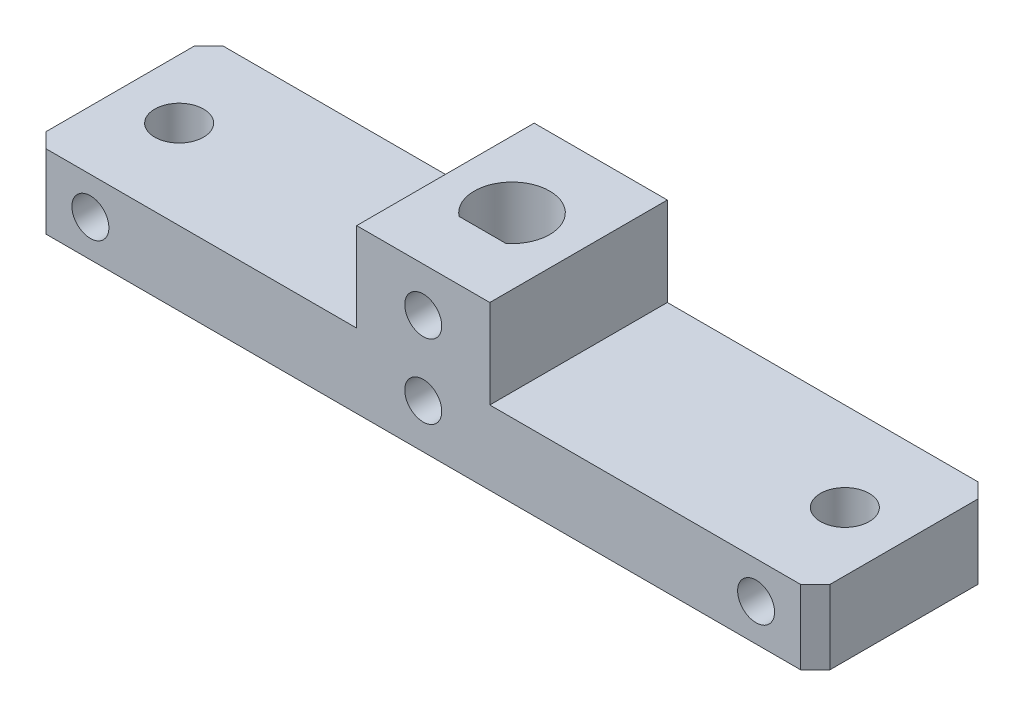
from build123d import *

# Parameters (mm, degrees)
BODY_EXTRUDE_DEPTH         = 12
M4X0_7_TAPPED_HOLE6_D      = 3.3
CUT_EXTRUDE1_DEPTH         = 32.10064308
M3X0_5_TAPPED_HOLE1_REACH  = 33.101
M3X0_5_TAPPED_HOLE1_BORE_R = 1.25
CHAMFER1_SIZE              = 1


with BuildPart() as part:
    # Body Sketch → Body Extrude (new body)
    with BuildSketch(Plane.XY):
        Polygon((-26.5, 0), (26.5, 0), (26.5, 5), (4.5, 5), (4.5, 11), (-4.5, 11), (-4.5, 5), (-26.5, 5), align=None)
    extrude(amount=-BODY_EXTRUDE_DEPTH)

    # M4x0.7 Tapped Hole6 (through all)
    with Locations(Plane.XZ):
        with Locations((-22.5, -6), (22.5, -6)):
            Hole(M4X0_7_TAPPED_HOLE6_D / 2)

    # Sketch2 → Cut-Extrude1 (cut, through all)
    with BuildSketch(Plane(origin=(0, 0, 0), x_dir=(1, 0, 0), z_dir=(0, 1, 0))):
        with BuildLine():
            Line((-1.581929202, 4), (1.581929202, 4))
            ThreePointArc((1.581929202, 4), (0, 8.55), (-1.581929202, 4))
        make_face()
    extrude(amount=CUT_EXTRUDE1_DEPTH, mode=Mode.SUBTRACT)

    # M3x0.5 Tapped Hole1 bore → M3x0.5 Tapped Hole1 (cut, up to next)
    with BuildSketch(Plane.XY, mode=Mode.PRIVATE) as m3x0_5_tapped_hole1_sk1:
        with Locations((-22.5, 2.5)):
            Circle(M3X0_5_TAPPED_HOLE1_BORE_R)
    m3x0_5_tapped_hole1_tool1 = extrude(m3x0_5_tapped_hole1_sk1.sketch, amount=-M3X0_5_TAPPED_HOLE1_REACH, mode=Mode.PRIVATE) & part.part
    # M3x0.5 Tapped Hole1 bore → M3x0.5 Tapped Hole1 (cut, up to next)
    with BuildSketch(Plane.XY, mode=Mode.PRIVATE) as m3x0_5_tapped_hole1_sk2:
        with Locations((22.5, 2.5)):
            Circle(M3X0_5_TAPPED_HOLE1_BORE_R)
    m3x0_5_tapped_hole1_tool2 = extrude(m3x0_5_tapped_hole1_sk2.sketch, amount=-M3X0_5_TAPPED_HOLE1_REACH, mode=Mode.PRIVATE) & part.part
    # M3x0.5 Tapped Hole1 bore → M3x0.5 Tapped Hole1 (cut, up to next)
    with BuildSketch(Plane.XY, mode=Mode.PRIVATE) as m3x0_5_tapped_hole1_sk3:
        with Locations((0, 8)):
            Circle(M3X0_5_TAPPED_HOLE1_BORE_R)
    m3x0_5_tapped_hole1_tool3 = extrude(m3x0_5_tapped_hole1_sk3.sketch, amount=-M3X0_5_TAPPED_HOLE1_REACH, mode=Mode.PRIVATE) & part.part
    # M3x0.5 Tapped Hole1 bore → M3x0.5 Tapped Hole1 (cut, up to next)
    with BuildSketch(Plane.XY, mode=Mode.PRIVATE) as m3x0_5_tapped_hole1_sk4:
        with Locations((0, 3)):
            Circle(M3X0_5_TAPPED_HOLE1_BORE_R)
    m3x0_5_tapped_hole1_tool4 = extrude(m3x0_5_tapped_hole1_sk4.sketch, amount=-M3X0_5_TAPPED_HOLE1_REACH, mode=Mode.PRIVATE) & part.part
    add(m3x0_5_tapped_hole1_tool1.solids().sort_by_distance((-22.5, 2.5, 0))[0], mode=Mode.SUBTRACT)
    add(m3x0_5_tapped_hole1_tool2.solids().sort_by_distance((22.5, 2.5, 0))[0], mode=Mode.SUBTRACT)
    add(m3x0_5_tapped_hole1_tool3.solids().sort_by_distance((0, 8, 0))[0], mode=Mode.SUBTRACT)
    add(m3x0_5_tapped_hole1_tool4.solids().sort_by_distance((0, 3, 0))[0], mode=Mode.SUBTRACT)

    # Chamfer1
    chamfer1_edges = [part.edges().sort_by_distance(p)[0] for p in [
        (26.5, 2.5, 0),
        (-26.5, 2.5, 0),
        (26.5, 2.5, -12),
        (-26.5, 2.5, -12),
    ]]
    chamfer(chamfer1_edges, length=CHAMFER1_SIZE)


solid = part.part
